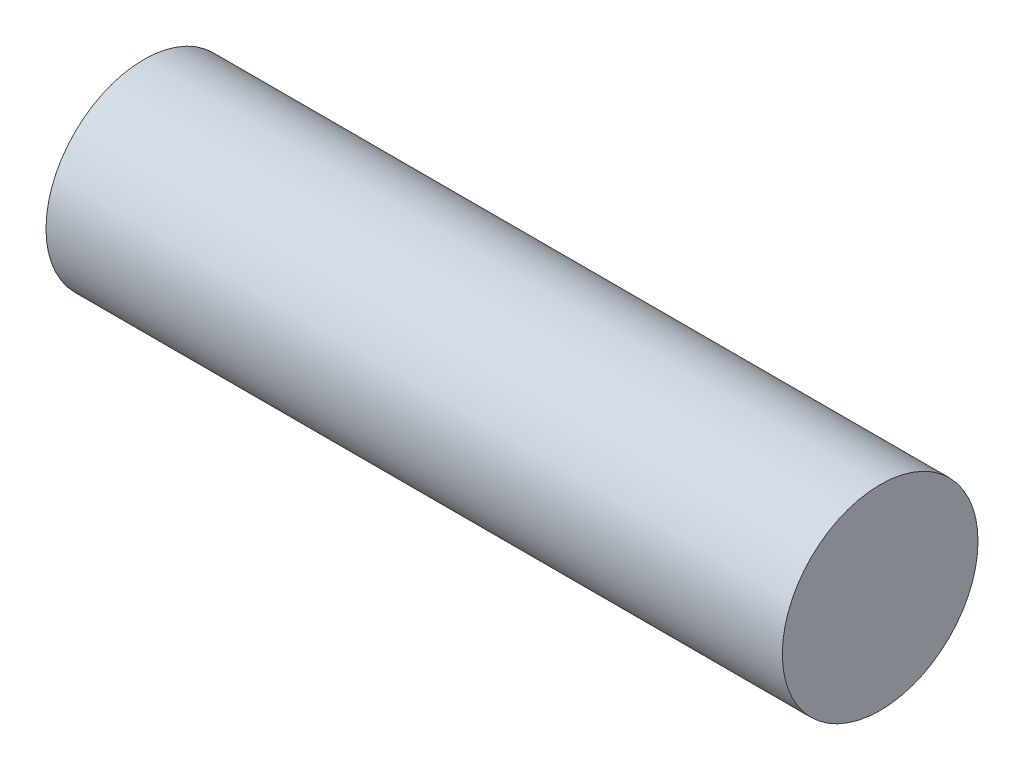
from build123d import *

# Parameters (mm, degrees)
SKETCH2_R           = 9.3
BOSS_EXTRUDE1_DEPTH = 70


with BuildPart() as part:
    # Sketch2 → Boss-Extrude1 (new body)
    with BuildSketch(Plane(origin=(0, 0, 0), x_dir=(0, 0, -1), z_dir=(1, 0, 0))):
        Circle(SKETCH2_R)
    extrude(amount=BOSS_EXTRUDE1_DEPTH)


solid = part.part
